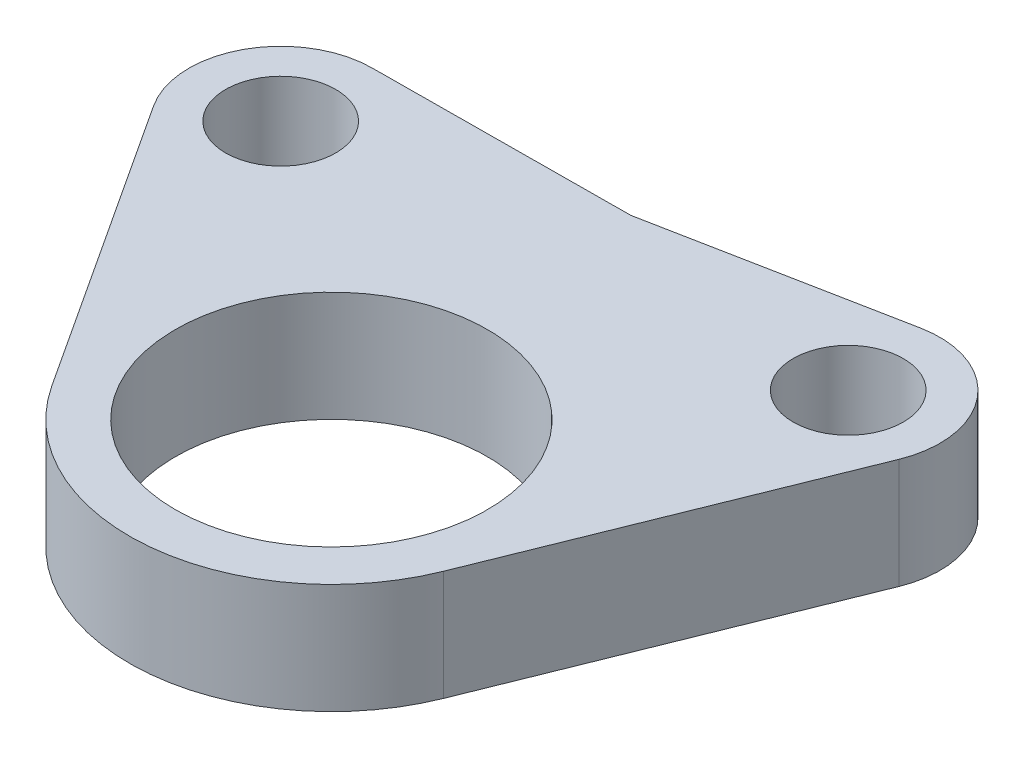
from build123d import *

# Parameters (mm, degrees)
CROQUIS1_R              = 8.5
CROQUIS1_R_2            = 3
SALIENTE_EXTRUIR1_DEPTH = 6


with BuildPart() as part:
    # Croquis1 → Saliente-Extruir1 (new body)
    with BuildSketch(Plane(origin=(0, 0, 0), x_dir=(1, 0, 0), z_dir=(0, 1, 0))):
        with BuildLine():
            Line((-9.210109587, -6.014472661), (-19.641820946, 9.959862948))
            ThreePointArc((-19.641820946, 9.959862948), (-19.860537089, 15.059054149), (-15.489180854, 17.693600092))
            Line((-15.489180854, 17.693600092), (-1.471942871, 17.788284087))
            Line((-1.471942871, 17.788284087), (11.737098306, 20.363042988))
            ThreePointArc((11.737098306, 20.363042988), (16.549311947, 18.638859347), (17.33162249, 13.587305173))
            Line((17.33162249, 13.587305173), (10.203398333, -4.109825113))
            ThreePointArc((10.203398333, -4.109825113), (1.074046649, -10.947439143), (-9.210109587, -6.014472661))
        make_face()
        with Locations(Location((0, 0, 0), (0, 0, 270))):
            Circle(CROQUIS1_R, mode=Mode.SUBTRACT)
        with Locations(Location((-15.455407497, 12.693714157, 0), (0, 0, 270))):
            Circle(CROQUIS1_R_2, mode=Mode.SUBTRACT)
        with Locations(Location((12.693714157, 15.455407497, 0), (0, 0, 270))):
            Circle(CROQUIS1_R_2, mode=Mode.SUBTRACT)
    extrude(amount=SALIENTE_EXTRUIR1_DEPTH)


solid = part.part
